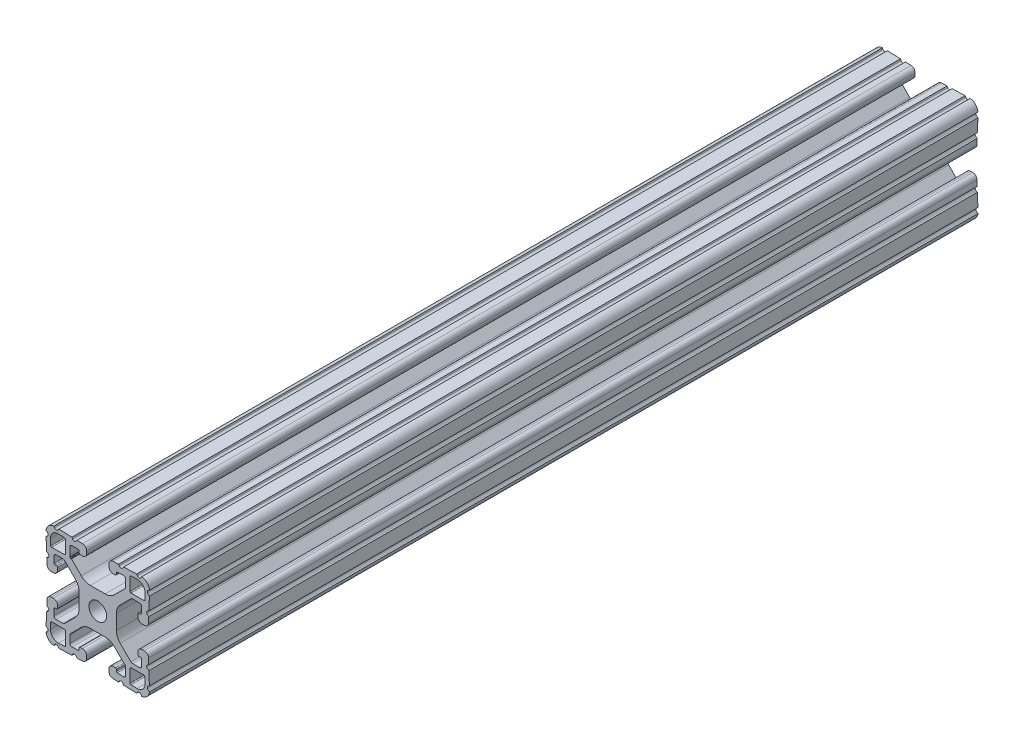
from build123d import *

# Parameters (mm, degrees)
BOSS_EXTRUDE1_DEPTH     = 152.4
CUT_EXTRUDE2_DEPTH      = 155.762931608
CUT_EXTRUDE2_DEPTH_BACK = 155.762931608
CUT_EXTRUDE1_DEPTH      = 155.759983075
CUT_EXTRUDE1_DEPTH_BACK = 155.759983075


with BuildPart() as part:
    # Sketch4 → Boss-Extrude1 (new, symmetric)
    with BuildSketch(Plane.XY):
        with BuildLine():
            Line((15.764194098, -19.048065876), (5.596097049, -18.692988103))
            ThreePointArc((5.596097049, -18.692988103), (4.509548067, -18.209225328), (4.064, -17.106455165))
            Line((4.064, -17.106455165), (4.064, -16.343990692))
            ThreePointArc((4.064, -16.343990692), (4.548729837, -15.202038759), (5.706902951, -14.757457754))
            Line((5.706902951, -14.757457754), (6.490296708, -14.784814467))
            ThreePointArc((6.490296708, -14.784814467), (6.751068464, -14.900917533), (6.858, -15.165582372))
            Line((6.858, -15.165582372), (6.858, -15.689138401))
            ThreePointArc((6.858, -15.689138401), (6.964931536, -15.95380324), (7.225703292, -16.069906306))
            Line((7.225703292, -16.069906306), (9.465548524, -16.148123425))
            ThreePointArc((9.465548524, -16.148123425), (10.044635082, -15.925832923), (10.287, -15.354856956))
            Line((10.287, -15.354856956), (10.287, -12.771043484))
            ThreePointArc((10.287, -12.771043484), (10.226579379, -12.46728851), (10.054516008, -12.209777477))
            Line((10.054516008, -12.209777477), (6.093922742, -8.249184211))
            ThreePointArc((6.093922742, -8.249184211), (4.552976719, -7.219556996), (2.735306952, -6.858))
            Line((2.735306952, -6.858), (0, -6.858))
            Line((0, -6.858), (0, -3.2639))
            ThreePointArc((0, -3.2639), (2.307925823, -2.307925823), (3.2639, 0))
            Line((3.2639, 0), (6.858, 0))
            Line((6.858, 0), (6.858, -2.735306952))
            ThreePointArc((6.858, -2.735306952), (7.219556996, -4.552976719), (8.249184211, -6.093922742))
            Line((8.249184211, -6.093922742), (12.209777477, -10.054516008))
            ThreePointArc((12.209777477, -10.054516008), (12.46728851, -10.226579379), (12.771043484, -10.287))
            Line((12.771043484, -10.287), (15.354856956, -10.287))
            ThreePointArc((15.354856956, -10.287), (15.925832923, -10.044635082), (16.148123425, -9.465548524))
            Line((16.148123425, -9.465548524), (16.069906306, -7.225703292))
            ThreePointArc((16.069906306, -7.225703292), (15.95380324, -6.964931536), (15.689138401, -6.858))
            Line((15.689138401, -6.858), (15.165582372, -6.858))
            ThreePointArc((15.165582372, -6.858), (14.900917533, -6.751068464), (14.784814467, -6.490296708))
            Line((14.784814467, -6.490296708), (14.757457754, -5.706902951))
            ThreePointArc((14.757457754, -5.706902951), (15.202038759, -4.548729837), (16.343990692, -4.064))
            Line((16.343990692, -4.064), (17.106455165, -4.064))
            ThreePointArc((17.106455165, -4.064), (18.209225328, -4.509548067), (18.692988103, -5.596097049))
            Line((18.692988103, -5.596097049), (19.048065876, -15.764194098))
            ThreePointArc((19.048065876, -15.764194098), (18.12006403, -18.12006403), (15.764194098, -19.048065876))
        make_face()
        with BuildLine():
            Line((11.8872, -12.2682), (11.8872, -16.943575443))
            ThreePointArc((11.8872, -16.943575443), (11.994131536, -17.208240282), (12.254903292, -17.324343348))
            Line((12.254903292, -17.324343348), (14.445350862, -17.400835462))
            ThreePointArc((14.445350862, -17.400835462), (16.565633801, -16.565633801), (17.400835462, -14.445350862))
            Line((17.400835462, -14.445350862), (17.324343348, -12.254903292))
            ThreePointArc((17.324343348, -12.254903292), (17.208240282, -11.994131536), (16.943575443, -11.8872))
            Line((16.943575443, -11.8872), (12.2682, -11.8872))
            ThreePointArc((12.2682, -11.8872), (11.998792316, -11.998792316), (11.8872, -12.2682))
        make_face(mode=Mode.SUBTRACT)
    extrude(amount=BOSS_EXTRUDE1_DEPTH, both=True)

    # Sketch8 → Cut-Extrude2 (cut, two sides: drawn at the far end of the back side and taken through both)
    with BuildSketch(Plane.XY.offset(-CUT_EXTRUDE2_DEPTH_BACK)):
        with BuildLine():
            Line((7.649186899, -18.76468358), (9.495813101, -18.829169188))
            Line((9.495813101, -18.829169188), (9.278946369, -18.421302187))
            ThreePointArc((9.278946369, -18.421302187), (8.600423087, -17.997313783), (7.893976718, -18.372937981))
            Line((7.893976718, -18.372937981), (7.649186899, -18.76468358))
        make_face()
        with BuildLine():
            Line((14.316686899, -18.997517811), (16.163313101, -19.062003418))
            Line((16.163313101, -19.062003418), (15.946446369, -18.654136417))
            ThreePointArc((15.946446369, -18.654136417), (15.267923087, -18.230148014), (14.561476718, -18.605772211))
            Line((14.561476718, -18.605772211), (14.316686899, -18.997517811))
        make_face()
        with BuildLine():
            Line((18.605772211, -14.561476718), (18.997517811, -14.316686899))
            Line((18.997517811, -14.316686899), (19.062003418, -16.163313101))
            Line((19.062003418, -16.163313101), (18.654136417, -15.946446369))
            ThreePointArc((18.654136417, -15.946446369), (18.230148014, -15.267923087), (18.605772211, -14.561476718))
        make_face()
        with BuildLine():
            Line((18.372937981, -7.893976718), (18.76468358, -7.649186899))
            Line((18.76468358, -7.649186899), (18.829169188, -9.495813101))
            Line((18.829169188, -9.495813101), (18.421302187, -9.278946369))
            ThreePointArc((18.421302187, -9.278946369), (17.997313783, -8.600423087), (18.372937981, -7.893976718))
        make_face()
    extrude(amount=CUT_EXTRUDE2_DEPTH + CUT_EXTRUDE2_DEPTH_BACK, mode=Mode.SUBTRACT)

    # Mirror1: part across plane


with BuildPart() as part_1:
    add(part.part)
    add(part.part.mirror(Plane(origin=(0, 0, 0), x_dir=(0, 0, 1), z_dir=(1, 0, 0))))

    # Mirror2: part across plane


with BuildPart() as part_2:
    add(part_1.part)
    add(part_1.part.mirror(Plane.ZX))

    # Sketch5 → Cut-Extrude1 (cut, two sides: drawn at the far end of the back side and taken through both)
    with BuildSketch(Plane.XY.offset(-CUT_EXTRUDE1_DEPTH_BACK)):
        with BuildLine():
            Line((-10.133783723, 12.50797511), (-10.133783723, 11.99997511))
            ThreePointArc((-10.133783723, 11.99997511), (-10.084187138, 11.880238362), (-9.964450389, 11.830641777))
            Line((-9.964450389, 11.830641777), (-9.650582015, 11.830641777))
            Line((-9.650582015, 11.830641777), (-9.650582015, 12.50797511))
            Line((-9.650582015, 12.50797511), (-10.133783723, 12.50797511))
        make_face()
    extrude(amount=CUT_EXTRUDE1_DEPTH + CUT_EXTRUDE1_DEPTH_BACK, mode=Mode.SUBTRACT)


solid = part_2.part
